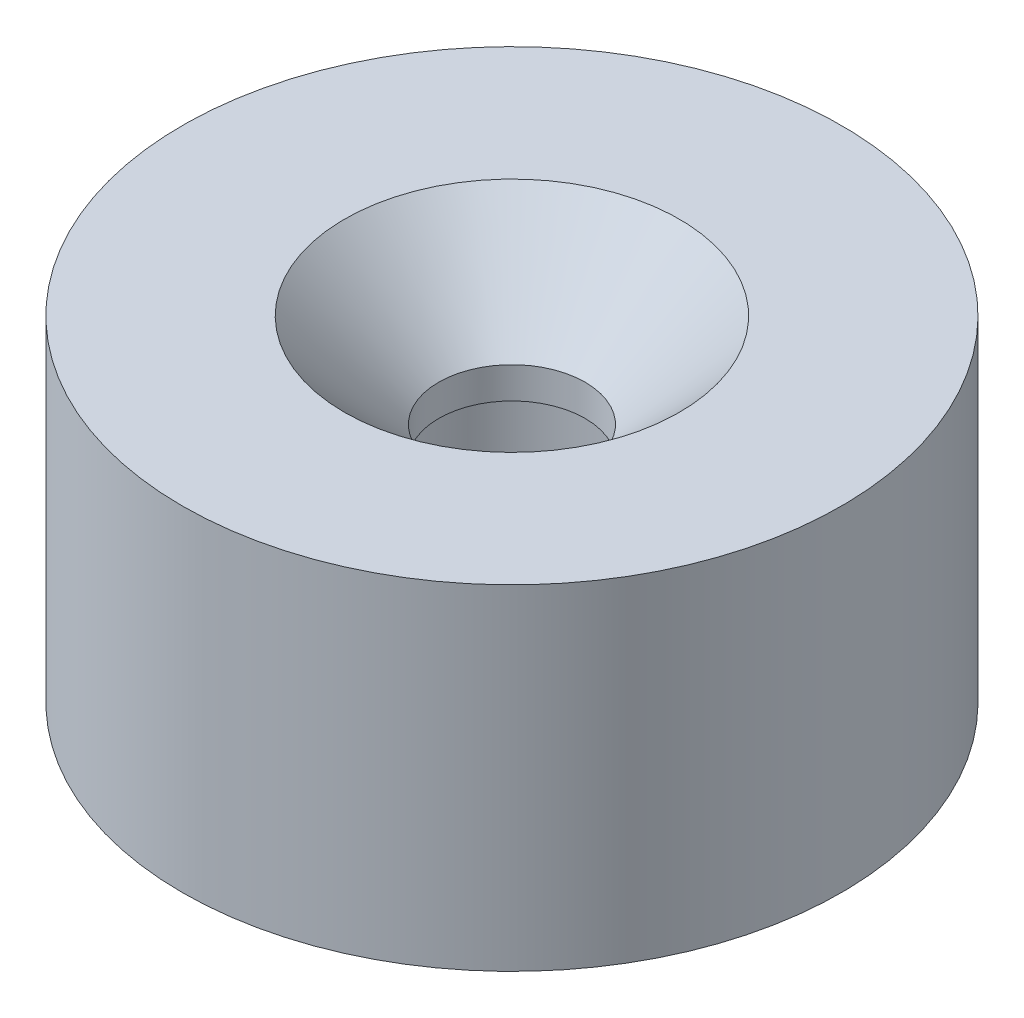
from build123d import *

# Parameters (mm, degrees)
SKETCH1_R           = 7.875
SKETCH1_R_2         = 1.75
BOSS_EXTRUDE1_DEPTH = 8
SKETCH2_R           = 4
CUT_EXTRUDE1_DEPTH  = 3
CUT_EXTRUDE1_DRAFT  = -45
SKETCH3_R           = 4
CUT_EXTRUDE2_DEPTH  = 5
BOSS_EXTRUDE2_START = 2
SKETCH4_R           = 4
SKETCH4_R_2         = 2.5
BOSS_EXTRUDE2_DEPTH = 2


with BuildPart() as part:
    # Sketch1 → Boss-Extrude1 (new body)
    with BuildSketch(Plane(origin=(0, 0, 0), x_dir=(1, 0, 0), z_dir=(0, 1, 0))):
        with Locations(Location((0, 0, 0), (0, 0, 270))):
            Circle(SKETCH1_R)
        with Locations(Location((0, 0, 0), (0, 0, 270))):
            Circle(SKETCH1_R_2, mode=Mode.SUBTRACT)
    extrude(amount=BOSS_EXTRUDE1_DEPTH)


with BuildPart() as cut_extrude1_tool:
    # Sketch2 → Cut-Extrude1 (with draft: the straight prism first)
    with BuildSketch(Plane(origin=(0, 8, 0), x_dir=(1, 0, 0), z_dir=(0, 1, 0))):
        Circle(SKETCH2_R)
    extrude(amount=-CUT_EXTRUDE1_DEPTH)
    # Cut-Extrude1: the draft: its side faces are tilted about the plane it starts from
    cut_extrude1_sides = [cut_extrude1_tool.faces().sort_by_distance(p)[0] for p in [
        (-4, 6.5, 0),
    ]]
    draft(cut_extrude1_sides, Plane(origin=(0, 8, 0), x_dir=(1, 0, 0), z_dir=(0, 1, 0)), CUT_EXTRUDE1_DRAFT)


with BuildPart() as part_1:
    add(part.part)

    # Cut-Extrude1: cut by cut_extrude1_tool
    add(cut_extrude1_tool.part, mode=Mode.SUBTRACT)

    # Sketch3 → Cut-Extrude2 (cut)
    with BuildSketch(Plane(origin=(0, 0, 0), x_dir=(-1, 0, 0), z_dir=(0, -1, 0))):
        with Locations(Location((0, 0, 0), (0, 0, 90))):
            Circle(SKETCH3_R)
    extrude(amount=-CUT_EXTRUDE2_DEPTH, mode=Mode.SUBTRACT)

    # Sketch4 → Boss-Extrude2 (add)
    with BuildSketch(Plane.XZ.offset(-5).offset(BOSS_EXTRUDE2_START)):
        with Locations(Location((0, 0, 0), (0, 0, 270))):
            Circle(SKETCH4_R)
        with Locations(Location((0, 0, 0), (0, 0, 270))):
            Circle(SKETCH4_R_2, mode=Mode.SUBTRACT)
    extrude(amount=-BOSS_EXTRUDE2_DEPTH)


solid = part_1.part
